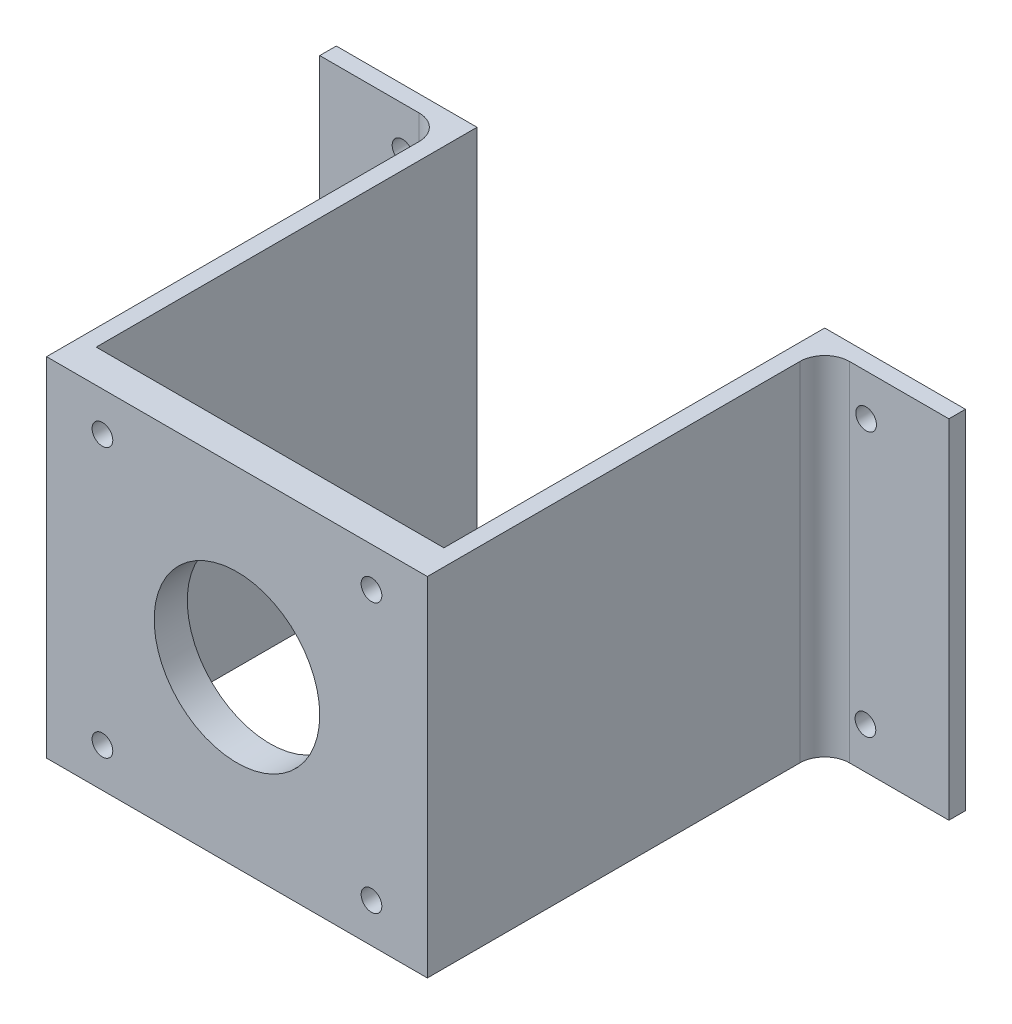
from build123d import *

# Parameters (mm, degrees)
CROQUIS1_W              = 46
CROQUIS1_H              = 42
SALIENTE_EXTRUIR1_DEPTH = 4
CROQUIS3_W              = 2
CROQUIS3_H              = 42
SALIENTE_EXTRUIR2_DEPTH = 46
CROQUIS4_W              = 2
CROQUIS4_H              = 42
SALIENTE_EXTRUIR3_DEPTH = 15
CROQUIS6_W              = 2
CROQUIS6_H              = 42
SALIENTE_EXTRUIR4_DEPTH = 15
CROQUIS8_R              = 1.25
CORTAR_EXTRUIR1_DEPTH   = 15
CORTAR_EXTRUIR2_DEPTH   = 15
CROQUIS10_R             = 1.25
CORTAR_EXTRUIR4_DEPTH   = 15
REDONDEO1_R             = 3
REDONDEO2_R             = 3
CROQUIS11_R             = 10
CORTAR_EXTRUIR5_DEPTH   = 15


with BuildPart() as part:
    # Croquis1 → Saliente-Extruir1 (new body)
    with BuildSketch(Plane.XY):
        with Locations((-61.749794594, 15.620374367)):
            Rectangle(CROQUIS1_W, CROQUIS1_H)
    extrude(amount=SALIENTE_EXTRUIR1_DEPTH)

    # Croquis3 → Saliente-Extruir2 (add)
    with BuildSketch(Plane(origin=(0, 0, 0), x_dir=(-1, 0, 0), z_dir=(0, 0, -1))):
        with Locations((83.749794594, 15.620374367)):
            Rectangle(CROQUIS3_W, CROQUIS3_H)
        with Locations((39.749794594, 15.620374367)):
            Rectangle(CROQUIS3_W, CROQUIS3_H)
    extrude(amount=SALIENTE_EXTRUIR2_DEPTH)

    # Croquis4 → Saliente-Extruir3 (add)
    with BuildSketch(Plane.ZY.offset(84.749794594)):
        with Locations((-45, 15.620374367)):
            Rectangle(CROQUIS4_W, CROQUIS4_H)
    extrude(amount=SALIENTE_EXTRUIR3_DEPTH)

    # Croquis6 → Saliente-Extruir4 (add)
    with BuildSketch(Plane(origin=(-38.749794594, 0, 0), x_dir=(0, 0, -1), z_dir=(1, 0, 0))):
        with Locations((45, 15.620374367)):
            Rectangle(CROQUIS6_W, CROQUIS6_H)
    extrude(amount=SALIENTE_EXTRUIR4_DEPTH)

    # Croquis8 → Cortar-Extruir1 (cut)
    with BuildSketch(Plane.XY.offset(4)):
        with Locations((-45.499794594, 31.870374367)):
            Circle(CROQUIS8_R)
        with BuildLine():
            ThreePointArc((-79.249794594, -0.629625633), (-78.88367807, -1.51350911), (-77.999794594, -1.879625633))
            Line((-77.999794594, -1.879625633), (-77.999794594, -0.629625633))
            Line((-77.999794594, -0.629625633), (-79.249794594, -0.629625633))
        make_face()
        with BuildLine():
            Line((-77.999794594, -0.629625633), (-77.999794594, -1.879625633))
            ThreePointArc((-77.999794594, -1.879625633), (-77.115911117, -1.51350911), (-76.749794594, -0.629625633))
            ThreePointArc((-76.749794594, -0.629625633), (-77.999794594, 0.620374367), (-79.249794594, -0.629625633))
            Line((-79.249794594, -0.629625633), (-77.999794594, -0.629625633))
        make_face()
        with Locations((-77.999794594, 31.870374367)):
            Circle(CROQUIS8_R)
    extrude(amount=-CORTAR_EXTRUIR1_DEPTH, mode=Mode.SUBTRACT)

    # Croquis7 → Cortar-Extruir2 (cut)
    with BuildSketch(Plane.XY.offset(4)):
        with BuildLine():
            ThreePointArc((-44.249794594, -0.629625633), (-46.38367807, 0.254257843), (-45.499794594, -1.879625633))
            Line((-45.499794594, -1.879625633), (-45.499794594, -0.629625633))
            Line((-45.499794594, -0.629625633), (-44.249794594, -0.629625633))
        make_face()
        with BuildLine():
            Line((-45.499794594, -0.629625633), (-45.499794594, -1.879625633))
            ThreePointArc((-45.499794594, -1.879625633), (-44.615911117, -1.51350911), (-44.249794594, -0.629625633))
            Line((-44.249794594, -0.629625633), (-45.499794594, -0.629625633))
        make_face()
    extrude(amount=-CORTAR_EXTRUIR2_DEPTH, mode=Mode.SUBTRACT)

    # Croquis10 → Cortar-Extruir4 (cut)
    with BuildSketch(Plane.XY.offset(-44)):
        with Locations((-33.749794594, 31.620374367)):
            Circle(CROQUIS10_R)
        with Locations((-33.829898146, -0.379625633)):
            Circle(CROQUIS10_R)
    cortar_extruir4 = extrude(amount=-CORTAR_EXTRUIR4_DEPTH, mode=Mode.SUBTRACT)

    # Simetría1: Cortar-Extruir4 across plane
    add(cortar_extruir4.mirror(Plane(origin=(-61.749794594, 0, 0), x_dir=(0, 0, 1), z_dir=(1, 0, 0))), mode=Mode.SUBTRACT)

    # Redondeo1
    redondeo1_edges = [part.edges().sort_by_distance(p)[0] for p in [
        (-84.749794594, 15.620374367, -44),
    ]]
    fillet(redondeo1_edges, radius=REDONDEO1_R)

    # Redondeo2
    redondeo2_edges = [part.edges().sort_by_distance(p)[0] for p in [
        (-38.749794594, 15.620374367, -44),
    ]]
    fillet(redondeo2_edges, radius=REDONDEO2_R)

    # Croquis11 → Cortar-Extruir5 (cut)
    with BuildSketch(Plane.XY.offset(4)):
        with Locations((-61.749794594, 15.620374367)):
            Circle(CROQUIS11_R)
    extrude(amount=-CORTAR_EXTRUIR5_DEPTH, mode=Mode.SUBTRACT)


solid = part.part
